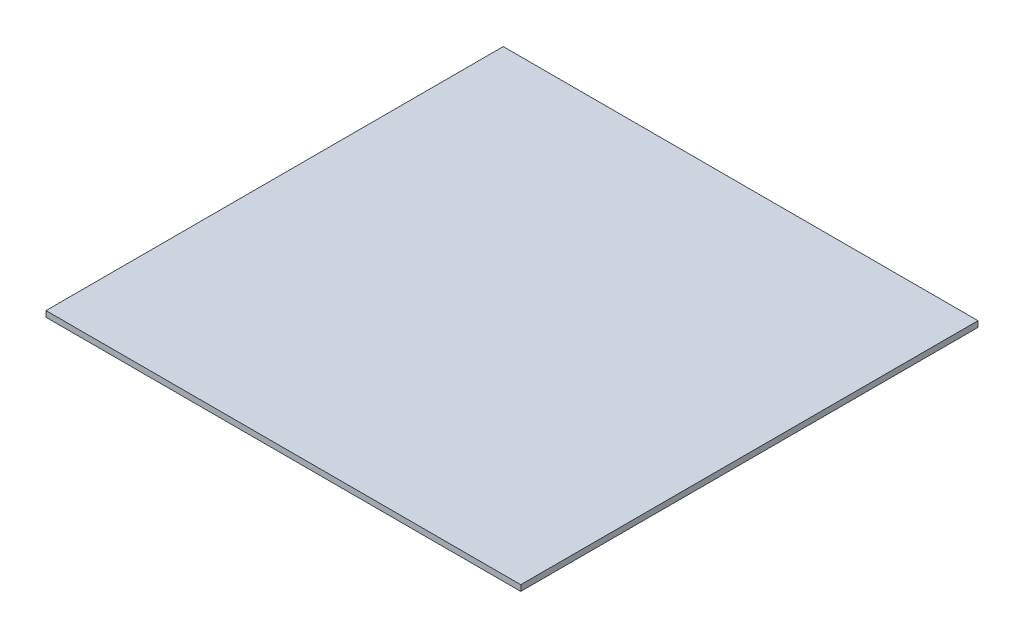
from build123d import *

# Parameters (mm, degrees)
SKETCH_1_W      = 244
SKETCH_1_H      = 235
EXTRUDE_1_DEPTH = 3


with BuildPart() as part:
    # 草图1 → 凸台-拉伸1 (new body)
    with BuildSketch(Plane(origin=(0, 0, 0), x_dir=(1, 0, 0), z_dir=(0, 1, 0))):
        with Locations((122, -117.5)):
            Rectangle(SKETCH_1_W, SKETCH_1_H)
    extrude(amount=EXTRUDE_1_DEPTH)


solid = part.part
